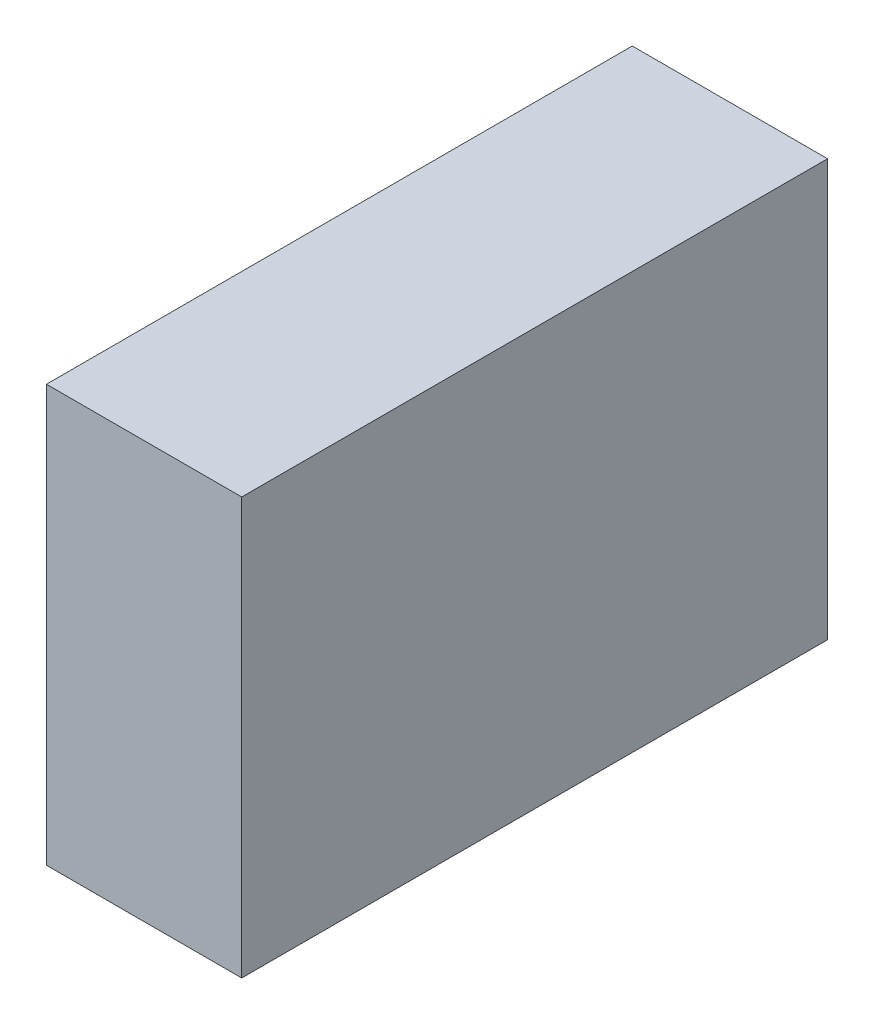
from build123d import *

# Parameters (mm, degrees)
SKETCH1_W           = 45
SKETCH1_H           = 32
BOSS_EXTRUDE1_DEPTH = 15


with BuildPart() as part:
    # Sketch1 → Boss-Extrude1 (new body)
    with BuildSketch(Plane(origin=(0, 0, 0), x_dir=(0, 0, -1), z_dir=(1, 0, 0))):
        Rectangle(SKETCH1_W, SKETCH1_H)
    extrude(amount=BOSS_EXTRUDE1_DEPTH)


solid = part.part
